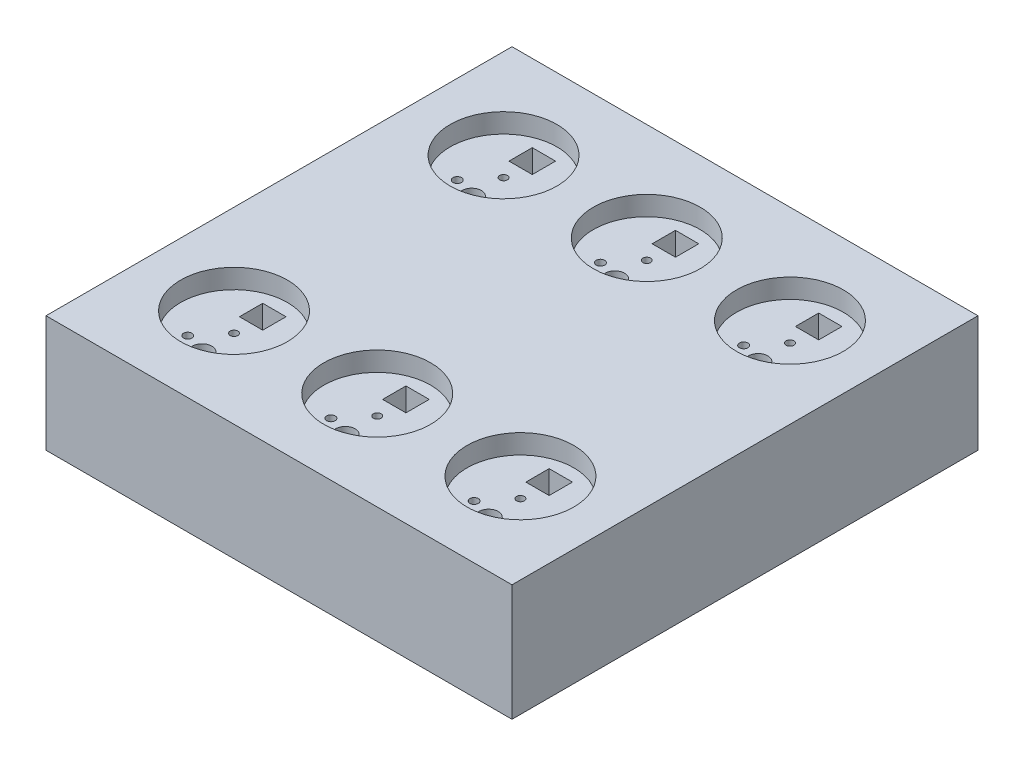
from build123d import *

# Parameters (mm, degrees)
SKETCH1_W           = 120
SKETCH1_H           = 120
BOSS_EXTRUDE1_DEPTH = 30
SKETCH2_R           = 13.75
CUT_EXTRUDE1_DEPTH  = 5
SKETCH3_R           = 1
SKETCH3_R_2         = 2.5
SKETCH3_R_3         = 1.089822964
SKETCH3_W           = 6
SKETCH3_H           = 6
CUT_EXTRUDE2_DEPTH  = 30
SKETCH6_R           = 13.75
CUT_EXTRUDE3_DEPTH  = 12
FILLET1_R           = 1


with BuildPart() as part:
    # Sketch1 → Boss-Extrude1 (new body)
    with BuildSketch(Plane(origin=(0, 0, 0), x_dir=(1, 0, 0), z_dir=(0, 1, 0))):
        Rectangle(SKETCH1_W, SKETCH1_H)
    extrude(amount=BOSS_EXTRUDE1_DEPTH)

    # Sketch2 → Cut-Extrude1 (cut)
    with BuildSketch(Plane(origin=(0, 30, 0), x_dir=(1, 0, 0), z_dir=(0, 1, 0))):
        with Locations(Location((0, 34.704194641, 0), (0, 0, 270))):
            Circle(SKETCH2_R)
        with Locations(Location((0, -34.704194641, 0), (0, 0, 90))):
            Circle(SKETCH2_R)
        with Locations(Location((36.875, -34.704194641, 0), (0, 0, 90))):
            Circle(SKETCH2_R)
        with Locations(Location((36.875, 34.704194641, 0), (0, 0, 270))):
            Circle(SKETCH2_R)
        with Locations(Location((-36.88, -34.704194641, 0), (0, 0, 90))):
            Circle(SKETCH2_R)
        with Locations(Location((-36.88, 34.704194641, 0), (0, 0, 270))):
            Circle(SKETCH2_R)
    extrude(amount=-CUT_EXTRUDE1_DEPTH, mode=Mode.SUBTRACT)

    # Sketch3 → Cut-Extrude2 (cut)
    with BuildSketch(Plane(origin=(0, 25, 0), x_dir=(1, 0, 0), z_dir=(0, 1, 0))):
        with Locations(Location((0, 34.704194641, 0), (0, 0, 270))):
            Circle(SKETCH3_R)
        with Locations(Location((0, -34.704194641, 0), (0, 0, 270))):
            Circle(SKETCH3_R)
        with Locations(Location((36.875, -34.704194641, 0), (0, 0, 270))):
            Circle(SKETCH3_R)
        with Locations(Location((36.875, 34.704194641, 0), (0, 0, 270))):
            Circle(SKETCH3_R)
        with Locations(Location((-36.88, -34.704194641, 0), (0, 0, 270))):
            Circle(SKETCH3_R)
        with Locations(Location((-36.88, 34.704194641, 0), (0, 0, 270))):
            Circle(SKETCH3_R)
        with Locations(Location((0, 26.492535085, 0), (0, 0, 270))):
            Circle(SKETCH3_R_2)
        with Locations(Location((-5.439834644, 28.22125216, 0), (0, 0, 270))):
            Circle(SKETCH3_R_3)
        with Locations(Location((36.88, 26.492535085, 0), (0, 0, 270))):
            Circle(SKETCH3_R_2)
        with Locations(Location((31.440165356, 28.22125216, 0), (0, 0, 270))):
            Circle(SKETCH3_R_3)
        with Locations(Location((-36.875, 26.492535085, 0), (0, 0, 270))):
            Circle(SKETCH3_R_2)
        with Locations(Location((-42.314834644, 28.22125216, 0), (0, 0, 270))):
            Circle(SKETCH3_R_3)
        with Locations(Location((0, -42.917464915, 0), (0, 0, 270))):
            Circle(SKETCH3_R_2)
        with Locations(Location((-5.439834644, -41.18874784, 0), (0, 0, 270))):
            Circle(SKETCH3_R_3)
        with Locations(Location((36.88, -42.917464915, 0), (0, 0, 270))):
            Circle(SKETCH3_R_2)
        with Locations(Location((31.440165356, -41.18874784, 0), (0, 0, 270))):
            Circle(SKETCH3_R_3)
        with Locations(Location((-36.875, -42.917464915, 0), (0, 0, 270))):
            Circle(SKETCH3_R_2)
        with Locations(Location((-42.314834644, -41.18874784, 0), (0, 0, 270))):
            Circle(SKETCH3_R_3)
        with Locations((36.88, 42.093646574)):
            Rectangle(SKETCH3_W, SKETCH3_H)
        with Locations((0, 42.093646574)):
            Rectangle(SKETCH3_W, SKETCH3_H)
        with Locations((-36.875, 42.093646574)):
            Rectangle(SKETCH3_W, SKETCH3_H)
        with Locations((36.88, -27.316353426)):
            Rectangle(SKETCH3_W, SKETCH3_H)
        with Locations((0, -27.316353426)):
            Rectangle(SKETCH3_W, SKETCH3_H)
        with Locations((-36.875, -27.316353426)):
            Rectangle(SKETCH3_W, SKETCH3_H)
    extrude(amount=-CUT_EXTRUDE2_DEPTH, mode=Mode.SUBTRACT)

    # Sketch6 → Cut-Extrude3 (cut)
    with BuildSketch(Plane.XZ):
        with Locations(Location((0.0025, 34.704194641, 0), (0, 0, 270))):
            Circle(SKETCH6_R)
        with Locations(Location((0.0025, -34.704194641, 0), (0, 0, 90))):
            Circle(SKETCH6_R)
        with Locations(Location((36.8775, -34.704194641, 0), (0, 0, 90))):
            Circle(SKETCH6_R)
        with Locations(Location((36.8775, 34.704194641, 0), (0, 0, 270))):
            Circle(SKETCH6_R)
        with Locations(Location((-36.8775, -34.704194641, 0), (0, 0, 90))):
            Circle(SKETCH6_R)
        with Locations(Location((-36.8775, 34.704194641, 0), (0, 0, 270))):
            Circle(SKETCH6_R)
    extrude(amount=-CUT_EXTRUDE3_DEPTH, mode=Mode.SUBTRACT)

    # Fillet1
    fillet1_edges = [part.edges().sort_by_distance(p)[0] for p in [
        (-36.8775, 0, 48.454194641),
        (-36.8775, 12, 48.454194641),
        (36.8775, 0, -48.454194641),
        (36.8775, 12, -48.454194641),
        (36.8775, 0, 48.454194641),
        (36.8775, 12, 48.454194641),
        (0.0025, 0, -48.454194641),
        (0.0025, 12, -48.454194641),
        (-36.8775, 0, -48.454194641),
        (-36.8775, 12, -48.454194641),
        (0.0025, 0, 48.454194641),
        (0.0025, 12, 48.454194641),
    ]]
    fillet(fillet1_edges, radius=FILLET1_R)


solid = part.part
